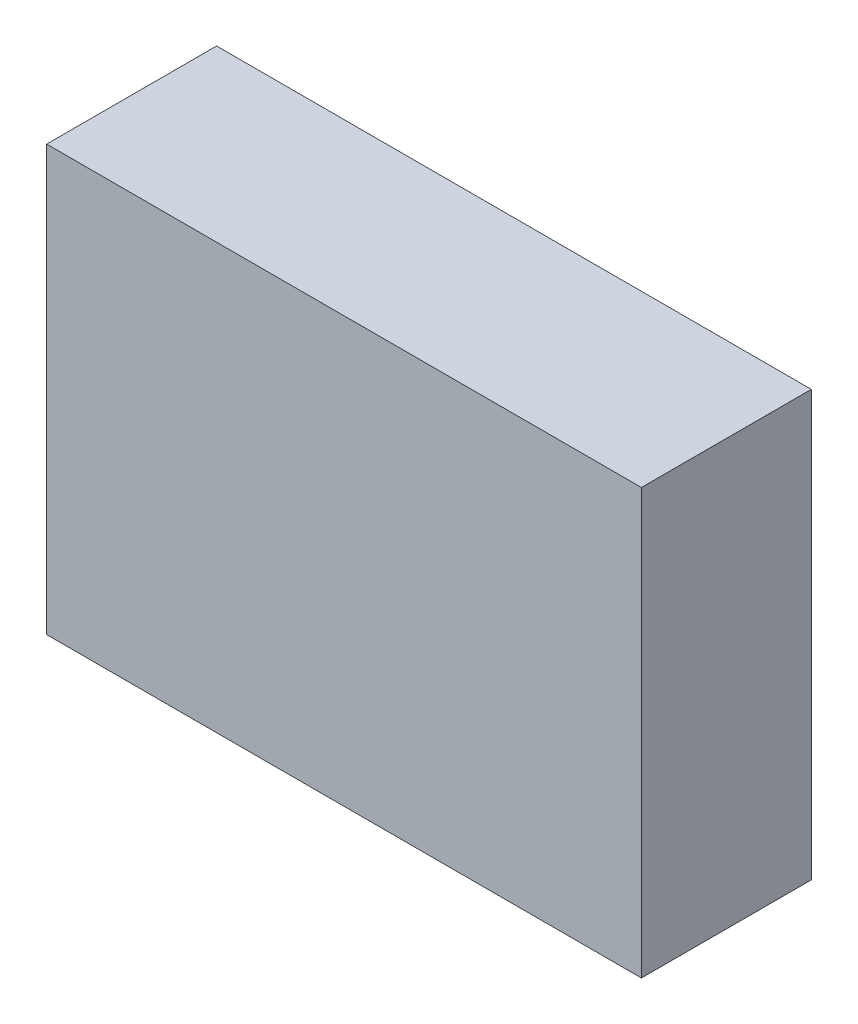
from build123d import *

# Parameters (mm, degrees)
SKETCH_1_W      = 70
SKETCH_1_H      = 50
EXTRUDE_1_DEPTH = 20


with BuildPart() as part:
    # 草图1 → 凸台-拉伸1 (new body)
    with BuildSketch(Plane.XY):
        Rectangle(SKETCH_1_W, SKETCH_1_H)
    extrude(amount=EXTRUDE_1_DEPTH)


solid = part.part
